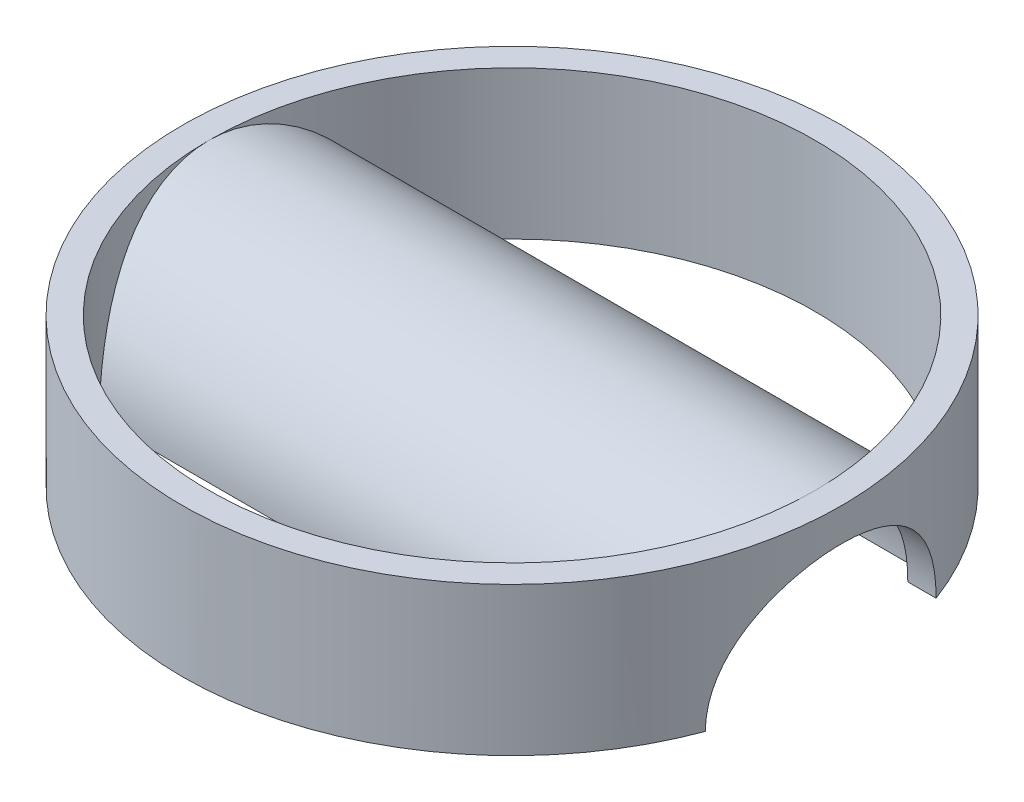
from build123d import *
from build123d.topology import SkipClean

# Parameters (mm, degrees)
SKETCH3_R             = 1.75
STIR_BAR_DEPTH        = 10
SKETCH4_W             = 10.5
SKETCH4_H             = 0.25
STIR_BAR_HOLDER_ANGLE = 180
BOSS_EXTRUDE1_DEPTH   = 2.25
SKETCH10_R            = 5.711829829
SKETCH10_R_2          = 5
CUT_EXTRUDE5_DEPTH    = 12.624328088
SKETCH9_R             = 1.75
CUT_EXTRUDE6_DEPTH    = 12.404494879


with BuildPart() as part:
    # Sketch3 → Stir Bar (new body)
    with BuildSketch(Plane(origin=(0, 0, 0), x_dir=(0, 0, -1), z_dir=(1, 0, 0))):
        Circle(SKETCH3_R)
    extrude(amount=STIR_BAR_DEPTH)



with BuildPart() as body_2:
    # Sketch4 → Stir Bar Holder (revolve)
    with BuildSketch(Plane(origin=(0, 0, 0), x_dir=(1, 0, 0), z_dir=(0, 1, 0))):
        with Locations((5, 2.125)):
            Rectangle(SKETCH4_W, SKETCH4_H)
    revolve(axis=Axis((-0.25, 0, 0), (1, 0, 0)), revolution_arc=STIR_BAR_HOLDER_ANGLE)


with BuildPart() as part_1:
    with SkipClean():  # the faces are left unmerged after this step: merging them gives an invalid solid
        add(part.part)

        add(body_2.part)  # Boss-Extrude1 merges body 2
        # Sketch5 → Boss-Extrude1 (add, through all)
        with BuildSketch(Plane.XZ):
            with BuildLine():
                ThreePointArc((0.987831011, 2.25), (5, 4.6), (9.012168989, 2.25))
                Line((9.012168989, 2.25), (9.465142775, 2.25))
                ThreePointArc((9.465142775, 2.25), (5, 5), (0.534857225, 2.25))
                Line((0.534857225, 2.25), (0.987831011, 2.25))
            make_face()
            with BuildLine():
                ThreePointArc((9.012168989, 2.25), (9.079231651, 2.125998385), (9.142463035, 2))
                Line((9.142463035, 2), (9.582575695, 2))
                ThreePointArc((9.582575695, 2), (9.52558586, 2.125811051), (9.465142775, 2.25))
                Line((9.465142775, 2.25), (9.012168989, 2.25))
            make_face()
            with BuildLine():
                Line((0.417424305, 2), (0.857536965, 2))
                ThreePointArc((0.857536965, 2), (0.920768349, 2.125998385), (0.987831011, 2.25))
                Line((0.987831011, 2.25), (0.534857225, 2.25))
                ThreePointArc((0.534857225, 2.25), (0.47441414, 2.125811051), (0.417424305, 2))
            make_face()
            with BuildLine():
                ThreePointArc((9.142463035, 2), (9.484157109, 1.025833816), (9.6, 0))
                Line((9.6, 0), (10, 0))
                ThreePointArc((10, 0), (9.894531565, 1.021548218), (9.582575695, 2))
                Line((9.582575695, 2), (9.142463035, 2))
            make_face()
            with BuildLine():
                Line((0, 0), (0.4, 0))
                ThreePointArc((0.4, 0), (0.515842891, 1.025833816), (0.857536965, 2))
                Line((0.857536965, 2), (0.417424305, 2))
                ThreePointArc((0.417424305, 2), (0.105468435, 1.021548218), (0, 0))
            make_face()
            with BuildLine():
                Line((10, 0), (9.6, 0))
                ThreePointArc((9.6, 0), (5, -4.6), (0.4, 0))
                Line((0.4, 0), (0, 0))
                ThreePointArc((0, 0), (5, -5), (10, 0))
            make_face()
        extrude(amount=-BOSS_EXTRUDE1_DEPTH)

    # Sketch10 → Cut-Extrude5 (cut, through all)
    with BuildSketch(Plane.XZ):
        with Locations((5, 0)):
            Circle(SKETCH10_R)
        with Locations(Location((5, 0, 0), (0, 0, 270))):
            Circle(SKETCH10_R_2, mode=Mode.SUBTRACT)
    extrude(amount=-CUT_EXTRUDE5_DEPTH, mode=Mode.SUBTRACT)

    # Sketch9 → Cut-Extrude6 (cut, through all)
    with BuildSketch(Plane.ZY):
        Circle(SKETCH9_R)
    extrude(amount=-CUT_EXTRUDE6_DEPTH, mode=Mode.SUBTRACT)


solid = part_1.part
